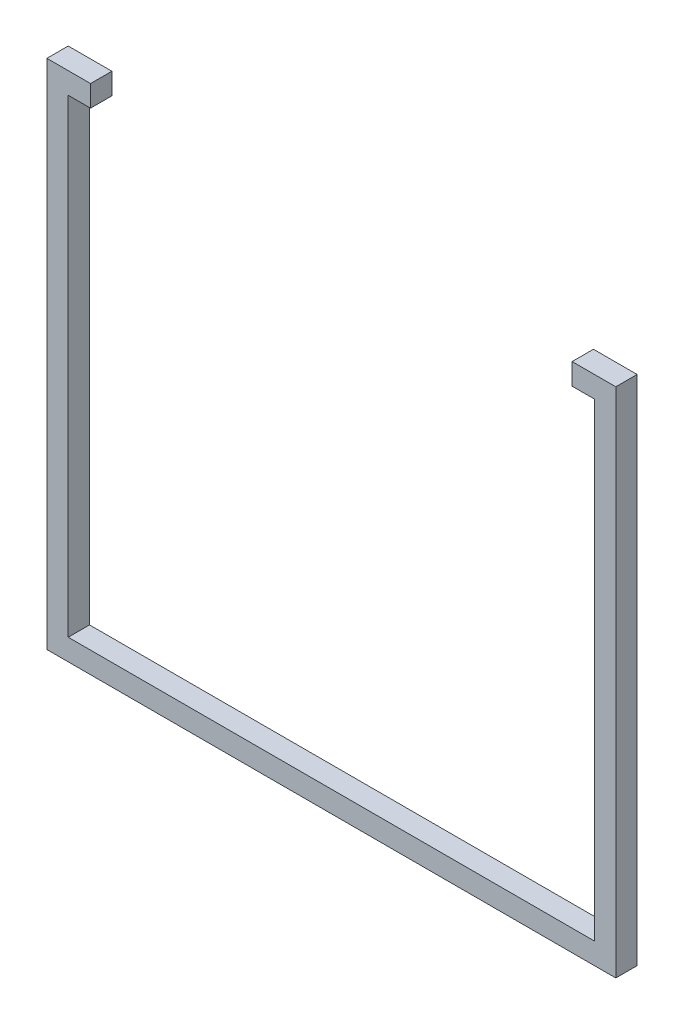
from build123d import *

# Parameters (mm, degrees)
SKETCH1_W           = 508
SKETCH1_H           = 457.2
SKETCH1_W_2         = 469.9
SKETCH1_H_2         = 419.1
BOSS_EXTRUDE1_DEPTH = 19.05
SKETCH2_W           = 430
SKETCH2_H           = 19.05
CUT_EXTRUDE1_DEPTH  = 684.709545421


with BuildPart() as part:
    # Sketch1 → Boss-Extrude1 (new body)
    with BuildSketch(Plane.XY):
        with Locations((254, 228.6)):
            Rectangle(SKETCH1_W, SKETCH1_H)
        with Locations((254, 228.6)):
            Rectangle(SKETCH1_W_2, SKETCH1_H_2, mode=Mode.SUBTRACT)
    extrude(amount=BOSS_EXTRUDE1_DEPTH)

    # Sketch2 → Cut-Extrude1 (cut, through all)
    with BuildSketch(Plane.XY.offset(19.05)):
        with Locations((254, 447.675)):
            Rectangle(SKETCH2_W, SKETCH2_H)
    extrude(amount=-CUT_EXTRUDE1_DEPTH, mode=Mode.SUBTRACT)


solid = part.part
